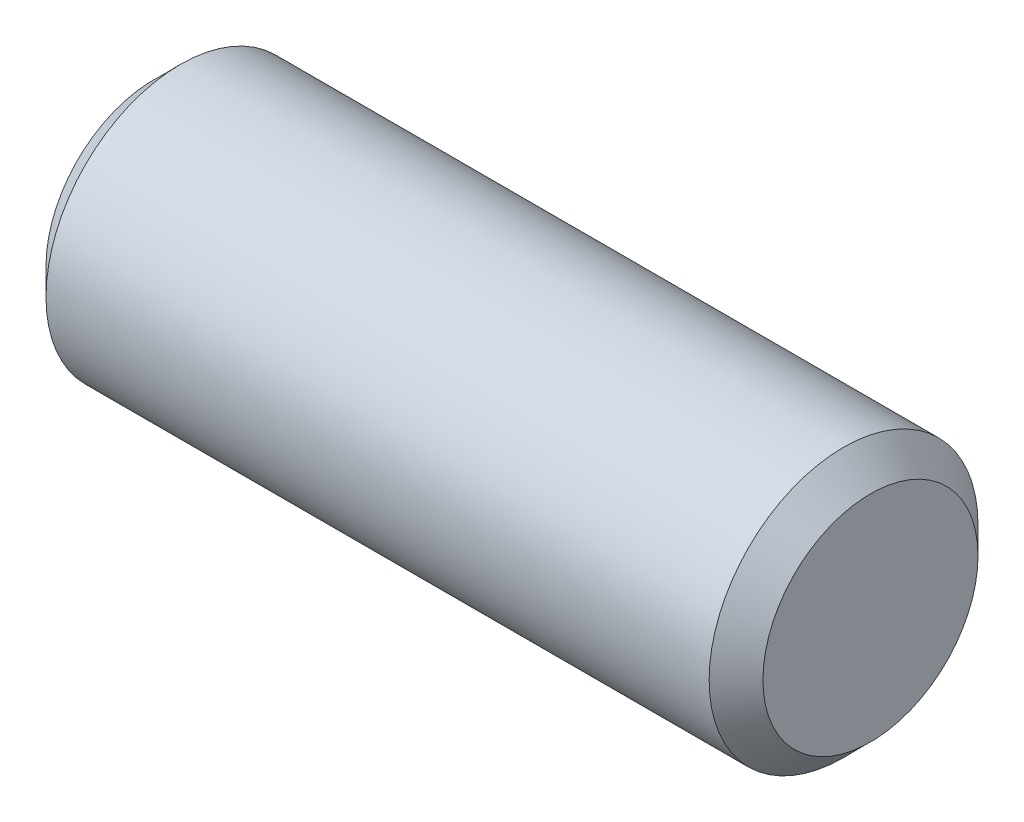
from build123d import *

# Parameters (mm, degrees)
EXTRUDE1_DEPTH      = 25.4
EXTRUDE1_DEPTH_BACK = 25.4
SKETCH2_R           = 9.525
CHAMFER1_SIZE       = 1.905


with BuildPart() as part:
    # Sketch2 → Extrude1 (new, two sides: drawn at the far end of the back side and taken through both)
    with BuildSketch(Plane(origin=(0, 0, 0), x_dir=(0, 0, -1), z_dir=(1, 0, 0)).offset(-EXTRUDE1_DEPTH_BACK)):
        Circle(SKETCH2_R)
    extrude(amount=EXTRUDE1_DEPTH + EXTRUDE1_DEPTH_BACK)

    # Chamfer1
    chamfer1_edges = [part.edges().sort_by_distance(p)[0] for p in [
        (-25.4, 0, 9.525),
        (25.4, 0, 9.525),
    ]]
    chamfer(chamfer1_edges, length=CHAMFER1_SIZE)


solid = part.part
